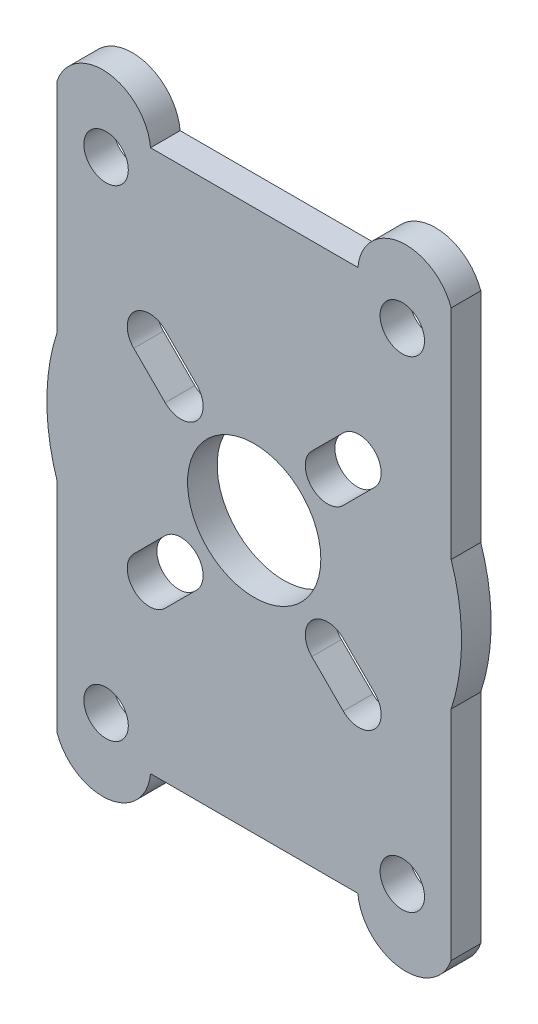
from build123d import *

# Parameters (mm, degrees)
BOSS_EXTRUDE1_DEPTH = 2
SKETCH2_R           = 4.5
SKETCH2_R_2         = 1.5
CUT_EXTRUDE1_DEPTH  = 2


with BuildPart() as part:
    # Sketch1 → Boss-Extrude1 (new body)
    with BuildSketch(Plane.XY):
        with BuildLine():
            Line((-13.3, 4.371498599), (-13.3, 18.3))
            Line((-13.3, 18.3), (-13.3, 19.084050384))
            ThreePointArc((-13.3, 19.084050384), (-9.834750168, 21.225119977), (-7, 18.3))
            Line((-7, 18.3), (7, 18.3))
            ThreePointArc((7, 18.3), (9.834750168, 21.225119977), (13.3, 19.084050384))
            Line((13.3, 19.084050384), (13.3, 18.3))
            Line((13.3, 18.3), (13.3, 4.371498599))
            ThreePointArc((13.3, 4.371498599), (14, 0), (13.3, -4.371498599))
            Line((13.3, -4.371498599), (13.3, -18.3))
            Line((13.3, -18.3), (13.3, -19.084050384))
            ThreePointArc((13.3, -19.084050384), (9.834750168, -21.225119977), (7, -18.3))
            Line((7, -18.3), (-7, -18.3))
            ThreePointArc((-7, -18.3), (-9.834750168, -21.225119977), (-13.3, -19.084050384))
            Line((-13.3, -19.084050384), (-13.3, -18.3))
            Line((-13.3, -18.3), (-13.3, -4.371498599))
            ThreePointArc((-13.3, -4.371498599), (-14, 0), (-13.3, 4.371498599))
        make_face()
    extrude(amount=BOSS_EXTRUDE1_DEPTH)

    # Sketch2 → Cut-Extrude1 (cut)
    with BuildSketch(Plane.XY.offset(2)):
        Circle(SKETCH2_R)
        with Locations((-10, 16.25)):
            Circle(SKETCH2_R_2)
        with Locations((10, 16.25)):
            Circle(SKETCH2_R_2)
        with Locations((-10, -16.25)):
            Circle(SKETCH2_R_2)
        with Locations((10, -16.25)):
            Circle(SKETCH2_R_2)
        with BuildLine():
            Line((3.889087297, 6.01040764), (6.01040764, 8.131727984))
            ThreePointArc((6.01040764, 8.131727984), (8.131727984, 8.131727984), (8.131727984, 6.01040764))
            Line((8.131727984, 6.01040764), (6.01040764, 3.889087297))
            ThreePointArc((6.01040764, 3.889087297), (3.889087297, 3.889087297), (3.889087297, 6.01040764))
        make_face()
        with BuildLine():
            Line((6.01040764, -3.889087297), (8.131727984, -6.01040764))
            ThreePointArc((8.131727984, -6.01040764), (8.131727984, -8.131727984), (6.01040764, -8.131727984))
            Line((6.01040764, -8.131727984), (3.889087297, -6.01040764))
            ThreePointArc((3.889087297, -6.01040764), (3.889087297, -3.889087297), (6.01040764, -3.889087297))
        make_face()
        with BuildLine():
            Line((-3.889087297, -6.01040764), (-6.01040764, -8.131727984))
            ThreePointArc((-6.01040764, -8.131727984), (-8.131727984, -8.131727984), (-8.131727984, -6.01040764))
            Line((-8.131727984, -6.01040764), (-6.01040764, -3.889087297))
            ThreePointArc((-6.01040764, -3.889087297), (-3.889087297, -3.889087297), (-3.889087297, -6.01040764))
        make_face()
        with BuildLine():
            Line((-6.01040764, 3.889087297), (-8.131727984, 6.01040764))
            ThreePointArc((-8.131727984, 6.01040764), (-8.131727984, 8.131727984), (-6.01040764, 8.131727984))
            Line((-6.01040764, 8.131727984), (-3.889087297, 6.01040764))
            ThreePointArc((-3.889087297, 6.01040764), (-3.889087297, 3.889087297), (-6.01040764, 3.889087297))
        make_face()
    extrude(amount=-CUT_EXTRUDE1_DEPTH, mode=Mode.SUBTRACT)


solid = part.part
